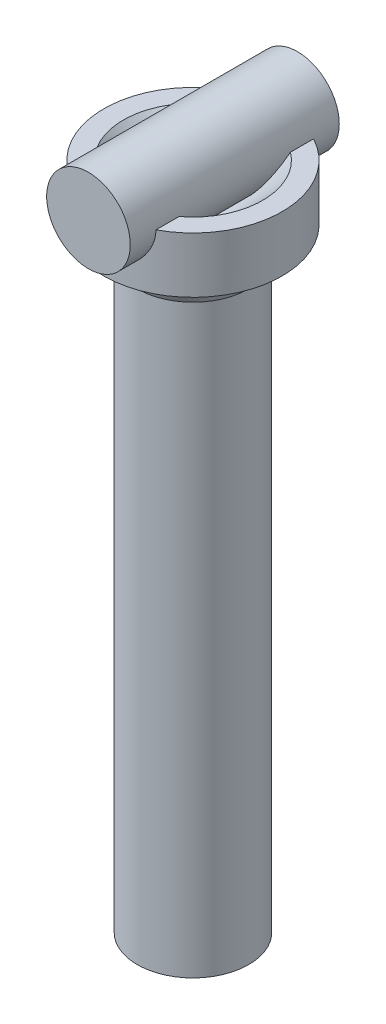
from build123d import *

# Parameters (mm, degrees)
SKETCH2_R           = 1.5
BOSS_EXTRUDE1_DEPTH = 3.75


with BuildPart() as part:
    # Sketch1 → Revolve1 (revolve)
    with BuildSketch(Plane.XY, mode=Mode.PRIVATE) as revolve1_sk:
        Polygon((0, 0), (0, 22), (0.5, 22), (2.5, 24), (3.2, 24), (3.2, 22), (2.40945179, 22), (2, 21), (2, 0), align=None)
    revolve(revolve1_sk.sketch.rotate(Axis((0, 0, 0), (0, 1, 0)), 90), axis=Axis((0, 0, 0), (0, 1, 0)))

    # Sketch2 → Boss-Extrude1 (add, symmetric)
    with BuildSketch(Plane.XY):
        with Locations((0, 24)):
            Circle(SKETCH2_R)
    extrude(amount=BOSS_EXTRUDE1_DEPTH, both=True)


solid = part.part
